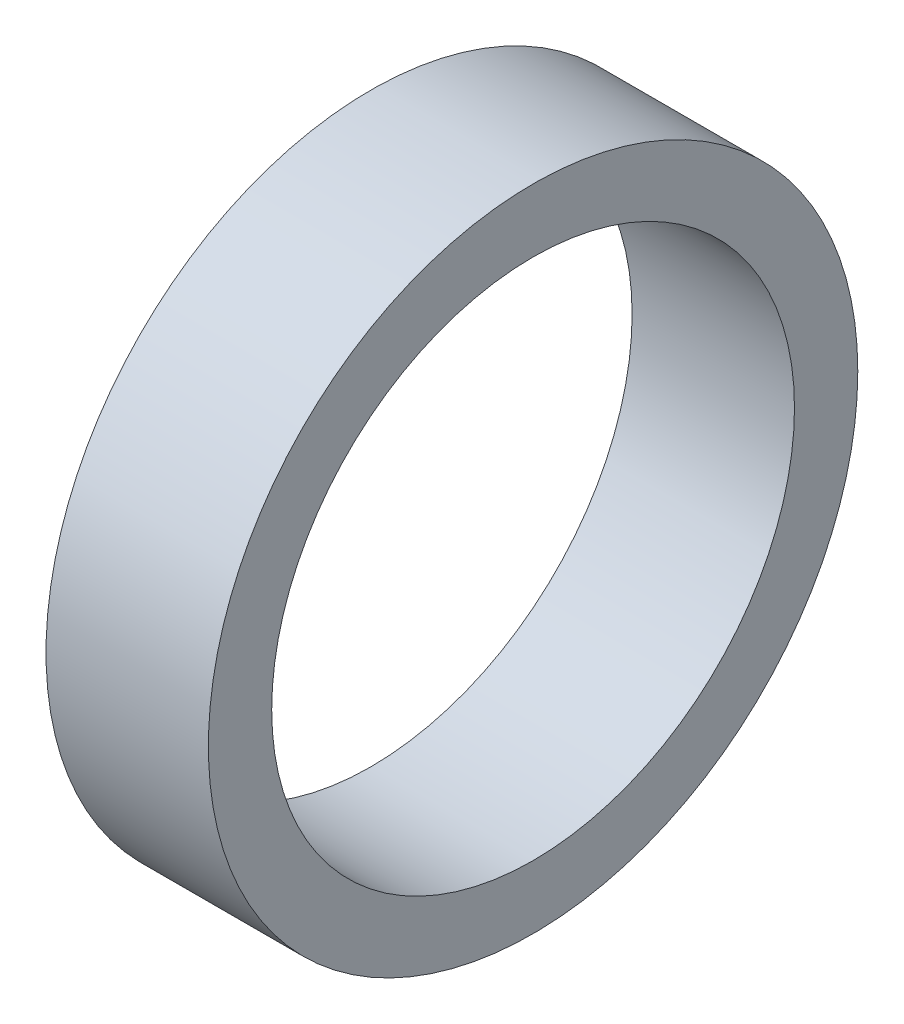
from build123d import *

# Parameters (mm, degrees)
SKETCH1_R           = 5
SKETCH1_R_2         = 4.025
BOSS_EXTRUDE1_DEPTH = 2.5


with BuildPart() as part:
    # Sketch1 → Boss-Extrude1 (new body)
    with BuildSketch(Plane(origin=(0, 0, 0), x_dir=(0, 0, -1), z_dir=(1, 0, 0))):
        Circle(SKETCH1_R)
        Circle(SKETCH1_R_2, mode=Mode.SUBTRACT)
    extrude(amount=BOSS_EXTRUDE1_DEPTH)


solid = part.part
